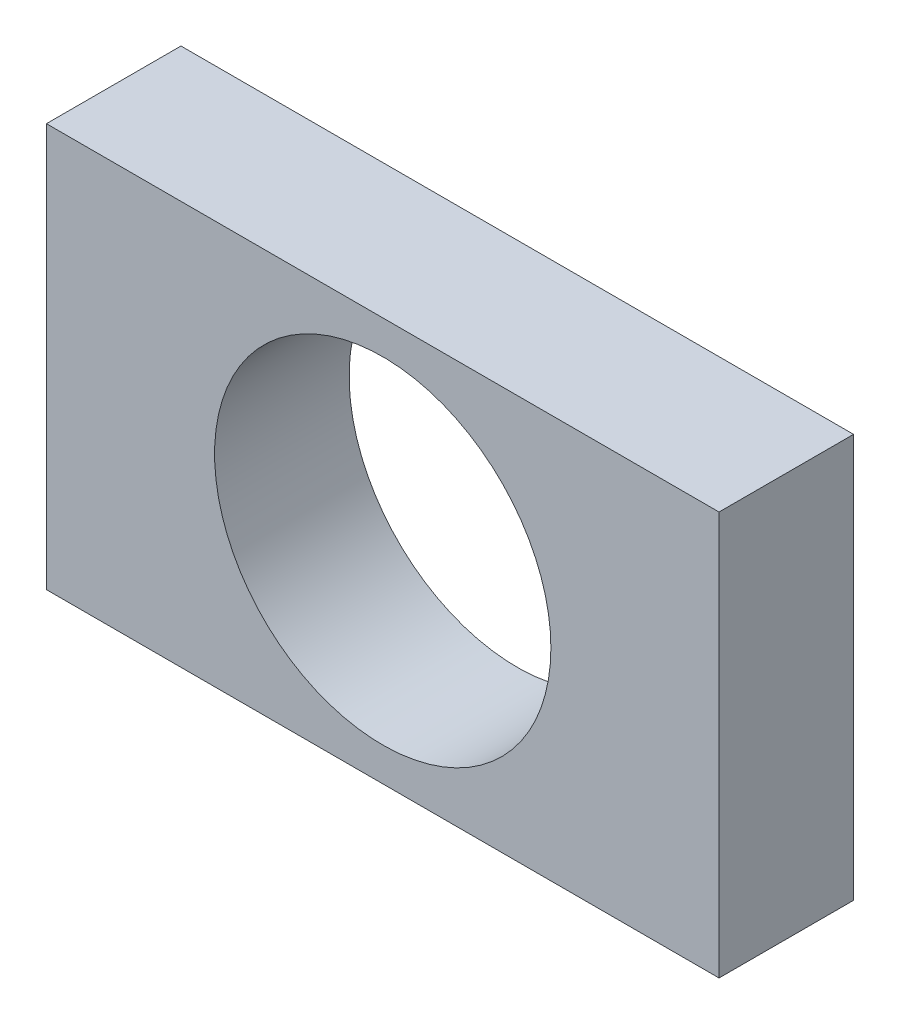
from build123d import *

# Parameters (mm, degrees)
SKETCH_1_W      = 100
SKETCH_1_H      = 60
SKETCH_1_R      = 25
EXTRUDE_1_DEPTH = 20


with BuildPart() as part:
    # Эскиз1 → Бобышка-Вытянуть1 (new body)
    with BuildSketch(Plane.XY):
        Rectangle(SKETCH_1_W, SKETCH_1_H)
        Circle(SKETCH_1_R, mode=Mode.SUBTRACT)
    extrude(amount=EXTRUDE_1_DEPTH)


solid = part.part
